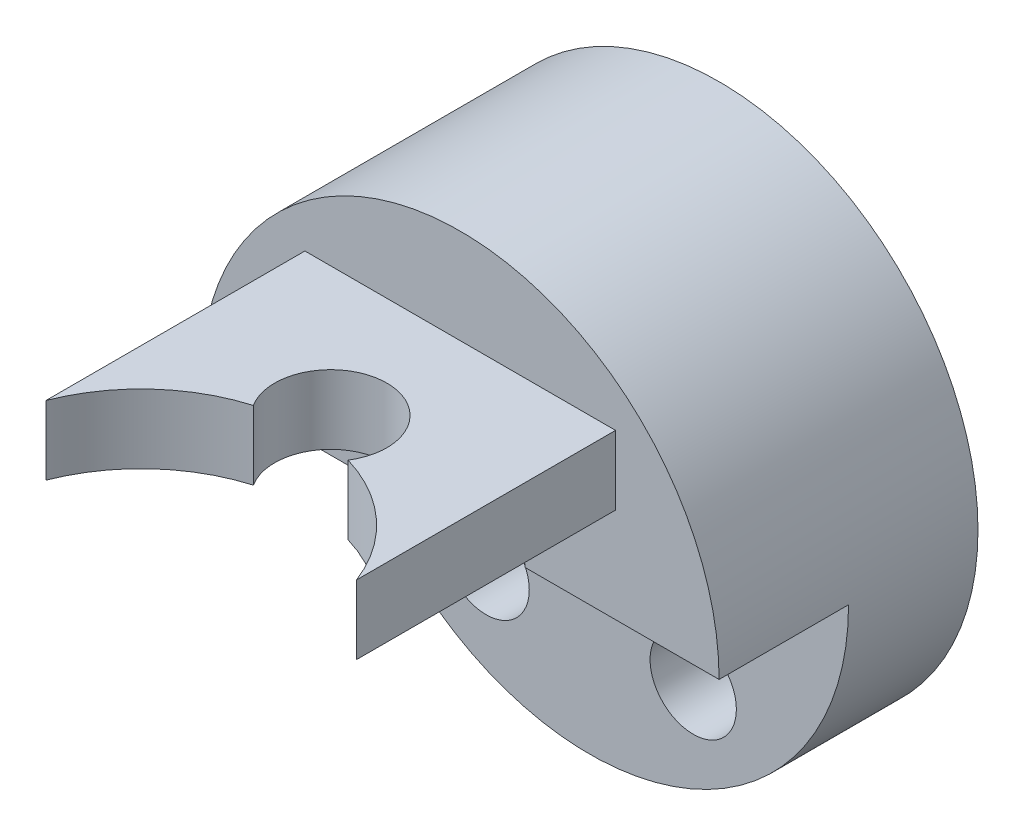
from build123d import *

# Parameters (mm, degrees)
SKETCH_1_R          = 30
EXTRUDE_1_DEPTH     = 15
EXTRUDE_2_DEPTH     = 15
SKETCH_3_R          = 7.5
CUT_EXTRUDE_1_DEPTH = 52.961524227
SKETCH_4_W          = 36
SKETCH_4_H          = 8
EXTRUDE_3_DEPTH     = 30
SKETCH_6_R          = 6.5
CUT_EXTRUDE_3_DEPTH = 79.619336044
SKETCH_5_R          = 19.313207916
CUT_EXTRUDE_4_DEPTH = 79.619336044
SKETCH_7_R          = 5
CUT_EXTRUDE_5_DEPTH = 62.846584384


with BuildPart() as part:
    # Эскиз1 → Бобышка-Вытянуть1 (new body)
    with BuildSketch(Plane.XY):
        Circle(SKETCH_1_R)
    extrude(amount=EXTRUDE_1_DEPTH)

    # Эскиз2 → Бобышка-Вытянуть2 (add)
    with BuildSketch(Plane.XY.offset(15)):
        with BuildLine():
            Line((-30, 0), (30, 0))
            ThreePointArc((30, 0), (0, 30), (-30, 0))
        make_face()
    extrude(amount=EXTRUDE_2_DEPTH)

    # Эскиз3 → Вырез-Вытянуть1 (cut, through all)
    with BuildSketch(Plane.XY.offset(30)):
        Circle(SKETCH_3_R)
    extrude(amount=-CUT_EXTRUDE_1_DEPTH, mode=Mode.SUBTRACT)

    # Эскиз4 → Бобышка-Вытянуть3 (add)
    with BuildSketch(Plane.XY.offset(30)):
        with Locations((0, 15)):
            Rectangle(SKETCH_4_W, SKETCH_4_H)
    extrude(amount=EXTRUDE_3_DEPTH)

    # Эскиз6 → Вырез-Вытянуть3 (cut, through all)
    with BuildSketch(Plane(origin=(0, 11, 0), x_dir=(-1, 0, 0), z_dir=(0, -1, 0))):
        with Locations(Location((0, -45, 0), (0, 0, 90))):
            Circle(SKETCH_6_R)
    extrude(amount=-CUT_EXTRUDE_3_DEPTH, mode=Mode.SUBTRACT)

    # Эскиз5 → Вырез-Вытянуть4 (cut, through all)
    with BuildSketch(Plane(origin=(0, 11, 0), x_dir=(-1, 0, 0), z_dir=(0, -1, 0))):
        with Locations((0, -67)):
            Circle(SKETCH_5_R)
    extrude(amount=-CUT_EXTRUDE_4_DEPTH, mode=Mode.SUBTRACT)

    # Эскиз7 → Вырез-Вытянуть5 (cut, through all)
    with BuildSketch(Plane.XY.offset(15)):
        with Locations((-12, -17)):
            Circle(SKETCH_7_R)
        with Locations((12, -17)):
            Circle(SKETCH_7_R)
    extrude(amount=-CUT_EXTRUDE_5_DEPTH, mode=Mode.SUBTRACT)


solid = part.part
